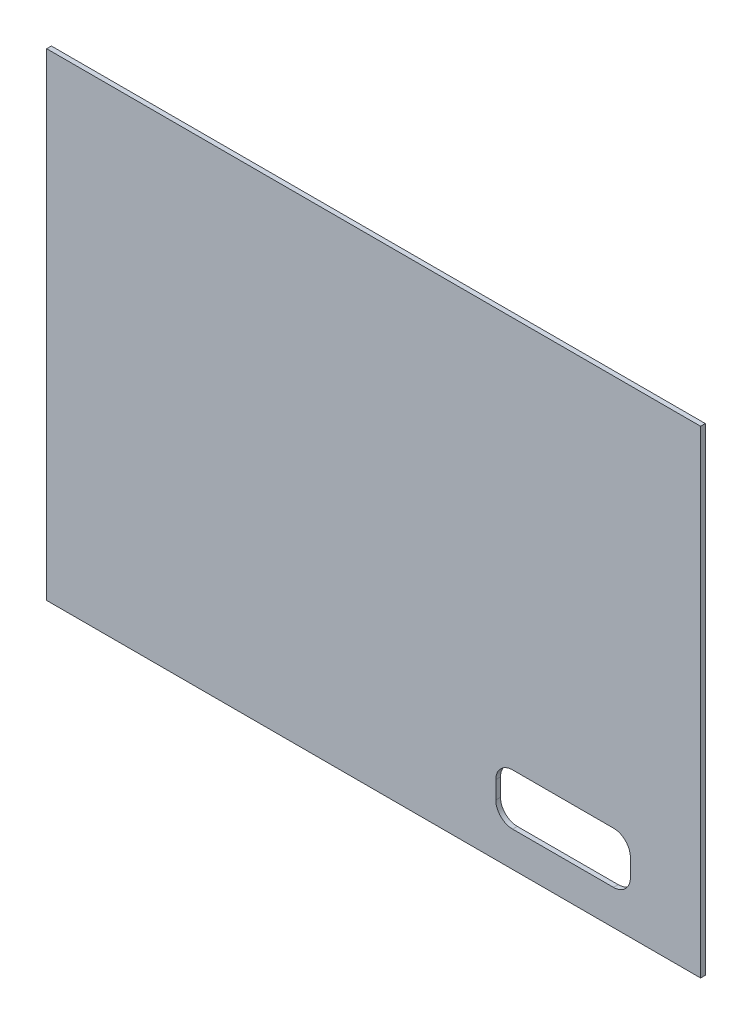
from build123d import *

# Parameters (mm, degrees)
SKETCH1_W           = 97.16644
SKETCH1_H           = 71
SKETCH1_W_2         = 20
SKETCH1_H_2         = 7.62
BOSS_EXTRUDE2_DEPTH = 0.7
BOSS_EXTRUDE3_DEPTH = 5
FILLET1_R           = 2.5


with BuildPart() as part:
    # Sketch1 → Boss-Extrude2 (new body)
    with BuildSketch(Plane.XY):
        with Locations((48.58322, 35.5)):
            Rectangle(SKETCH1_W, SKETCH1_H)
        with Locations((76.731936, 9.000673)):
            Rectangle(SKETCH1_W_2, SKETCH1_H_2, mode=Mode.SUBTRACT)
    extrude(amount=BOSS_EXTRUDE2_DEPTH)

    # Sketch1<4> → Boss-Extrude3 (add)
    with BuildSketch(Plane.XY):
        Polygon((25.266348, 63.75), (18.516348, 47.55), (18.516348, 37.85), (25.266348, 54.05), align=None)
        Polygon((10.891348, 64.75), (15.516348, 53.65), (20.141348, 64.75), align=None)
        Polygon((5.766348, 63.75), (5.766348, 54.05), (12.516348, 37.85), (12.516348, 47.55), align=None)
        Polygon((72.904973, 54.05), (79.654973, 37.85), (79.654973, 47.55), (72.904973, 63.75), align=None)
        Polygon((77.025092, 64.75), (81.650092, 53.65), (86.275092, 64.75), align=None)
        Polygon((91.400092, 63.75), (84.650092, 47.55), (84.650092, 37.85), (91.400092, 54.05), align=None)
    extrude(amount=-BOSS_EXTRUDE3_DEPTH)

    # Fillet1
    fillet1_edges = [part.edges().sort_by_distance(p)[0] for p in [
        (66.731936, 5.190673, 0.35),
        (66.731936, 12.810673, 0.35),
        (86.731936, 12.810673, 0.35),
        (86.731936, 5.190673, 0.35),
    ]]
    fillet(fillet1_edges, radius=FILLET1_R)


solid = part.part
